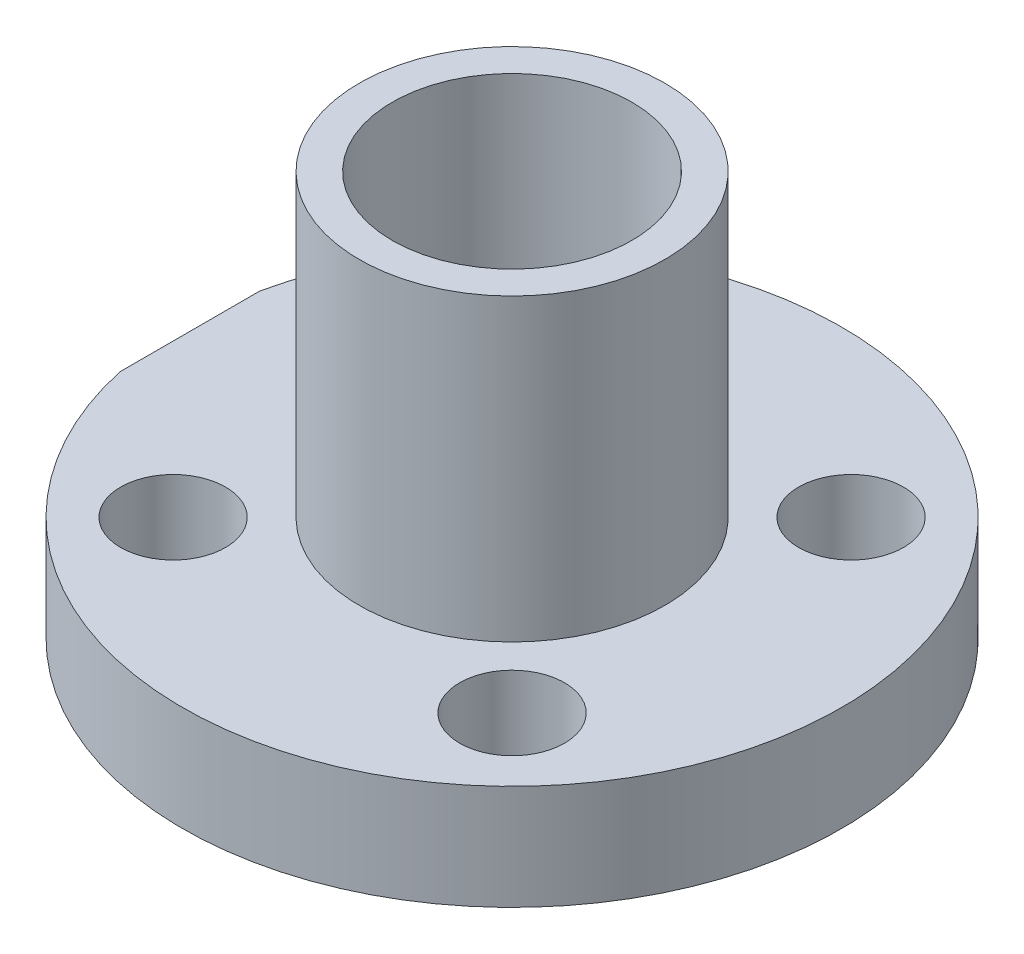
from build123d import *

# Parameters (mm, degrees)
F_3_5_3_5_DURCHMESSER_BOHRUNG1_D = 3.5
SKIZZE5_W                        = 0.5
SKIZZE5_H                        = 50
SCHNITT_LINEAR_AUSTRAGEN1_DEPTH  = 19.493242009


with BuildPart() as part:
    # Skizze1 → Rotation1 (revolve)
    with BuildSketch(Plane.XY, mode=Mode.PRIVATE) as rotation1_sk:
        Polygon((-4, 0), (-4, 13.5), (-5.1, 13.5), (-5.1, 3.5), (-11, 3.5), (-11, 0), (-5.1, 0), (-5.1, -1.5), (-4, -1.5), align=None)
    revolve(rotation1_sk.sketch.rotate(Axis((0, 0, 0), (0, 1, 0)), 270), axis=Axis((0, 0, 0), (0, 1, 0)))

    # Ø3.5 (3.5) Durchmesser Bohrung1 (through all)
    with Locations(Plane(origin=(0, 3.5, 0), x_dir=(1, 0, 0), z_dir=(0, 1, 0))):
        with Locations((5.656854249, 5.656854249), (-5.656854249, 5.656854249), (5.656854249, -5.656854249), (-5.656854249, -5.656854249)):
            Hole(F_3_5_3_5_DURCHMESSER_BOHRUNG1_D / 2)

    # Skizze5 → Schnitt-Linear austragen1 (cut, through all)
    with BuildSketch(Plane(origin=(0, 3.5, 0), x_dir=(1, 0, 0), z_dir=(0, 1, 0))):
        with Locations((-11, 0)):
            Rectangle(SKIZZE5_W, SKIZZE5_H)
    extrude(amount=-SCHNITT_LINEAR_AUSTRAGEN1_DEPTH, mode=Mode.SUBTRACT)


solid = part.part
